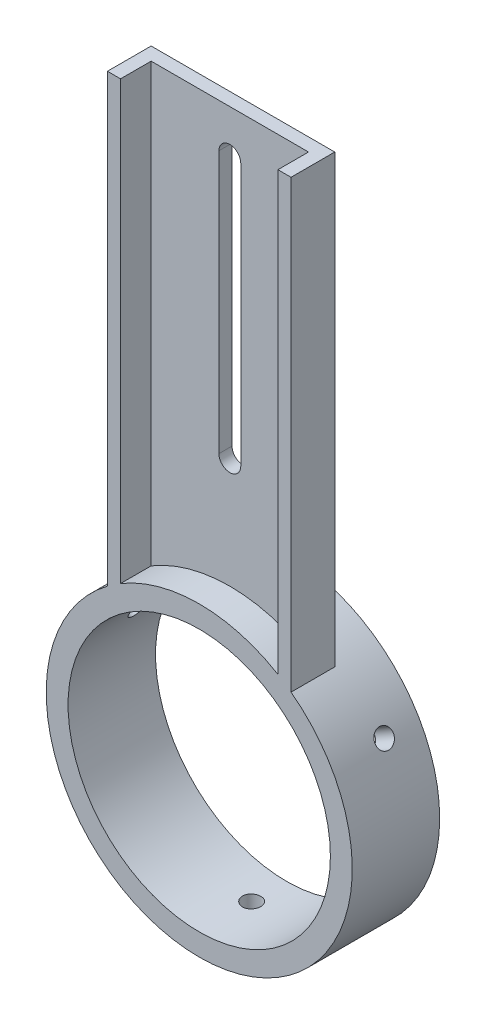
from build123d import *

# Parameters (mm, degrees)
SKETCH1_R           = 35
SKETCH1_R_2         = 30
BOSS_EXTRUDE1_DEPTH = 10
BOSS_EXTRUDE2_START = 3
BOSS_EXTRUDE2_DEPTH = 3
SKETCH3_W           = 10
SKETCH3_H           = 102
BOSS_EXTRUDE3_DEPTH = 3
SKETCH6_W           = 2.1
SKETCH6_H           = 95.310889132
CIRPATTERN1_COUNT   = 3
CUT_EXTRUDE1_REACH  = 137


with BuildPart() as part:
    # Sketch1 → Boss-Extrude1 (new, symmetric)
    with BuildSketch(Plane.XY):
        Circle(SKETCH1_R)
        Circle(SKETCH1_R_2, mode=Mode.SUBTRACT)
    extrude(amount=BOSS_EXTRUDE1_DEPTH, both=True)

    # Sketch2 → Boss-Extrude2 (add)
    with BuildSketch(Plane.XY.offset(BOSS_EXTRUDE2_START)):
        with BuildLine():
            Line((-21, 130), (21, 130))
            Line((21, 130), (21, 28))
            ThreePointArc((21, 28), (0, 35), (-21, 28))
            Line((-21, 28), (-21, 130))
        make_face()
    extrude(amount=-BOSS_EXTRUDE2_DEPTH)

    # Sketch3 → Boss-Extrude3 (add)
    with BuildSketch(Plane.ZY.offset(21)):
        with Locations((5, 79)):
            Rectangle(SKETCH3_W, SKETCH3_H)
    boss_extrude3 = extrude(amount=-BOSS_EXTRUDE3_DEPTH)

    # Mirror1: Boss-Extrude3 across plane
    add(boss_extrude3.mirror(Plane(origin=(0, 0, 0), x_dir=(0, 0, 1), z_dir=(1, 0, 0))))

    # Sketch6 → M5x0.8 Tapped Hole1 (revolve, cut)
    with BuildSketch(Plane(origin=(0, 0, -2), x_dir=(0, 0, 1), z_dir=(1, 0, 0))):
        with Locations((1.05, 47.655444566)):
            Rectangle(SKETCH6_W, SKETCH6_H)
    m5x0_8_tapped_hole1 = revolve(axis=Axis((0, 6.35, -2), (0, -1, 0)), mode=Mode.SUBTRACT)

    # CirPattern1: M5x0.8 Tapped Hole1 ×3 about axis
    cirpattern1_axis = Axis((0, 0, 10), (0, 0, -1))
    for i in range(1, CIRPATTERN1_COUNT):
        add(m5x0_8_tapped_hole1.rotate(cirpattern1_axis, i * 360 / CIRPATTERN1_COUNT), mode=Mode.SUBTRACT)

    # Sketch7 → Cut-Extrude1 (cut, up to next)
    with BuildSketch(Plane(origin=(0, 0, 0), x_dir=(-1, 0, 0), z_dir=(0, 0, -1)), mode=Mode.PRIVATE) as cut_extrude1_sk1:
        with BuildLine():
            Line((2.5, 120), (2.5, 60))
            ThreePointArc((2.5, 60), (0, 57.5), (-2.5, 60))
            Line((-2.5, 60), (-2.5, 120))
            ThreePointArc((-2.5, 120), (0, 122.5), (2.5, 120))
        make_face()
    cut_extrude1_tool1 = extrude(cut_extrude1_sk1.sketch, amount=-CUT_EXTRUDE1_REACH, mode=Mode.PRIVATE) & part.part
    add(cut_extrude1_tool1.solids().sort_by_distance((0, 90, 0))[0], mode=Mode.SUBTRACT)


solid = part.part
